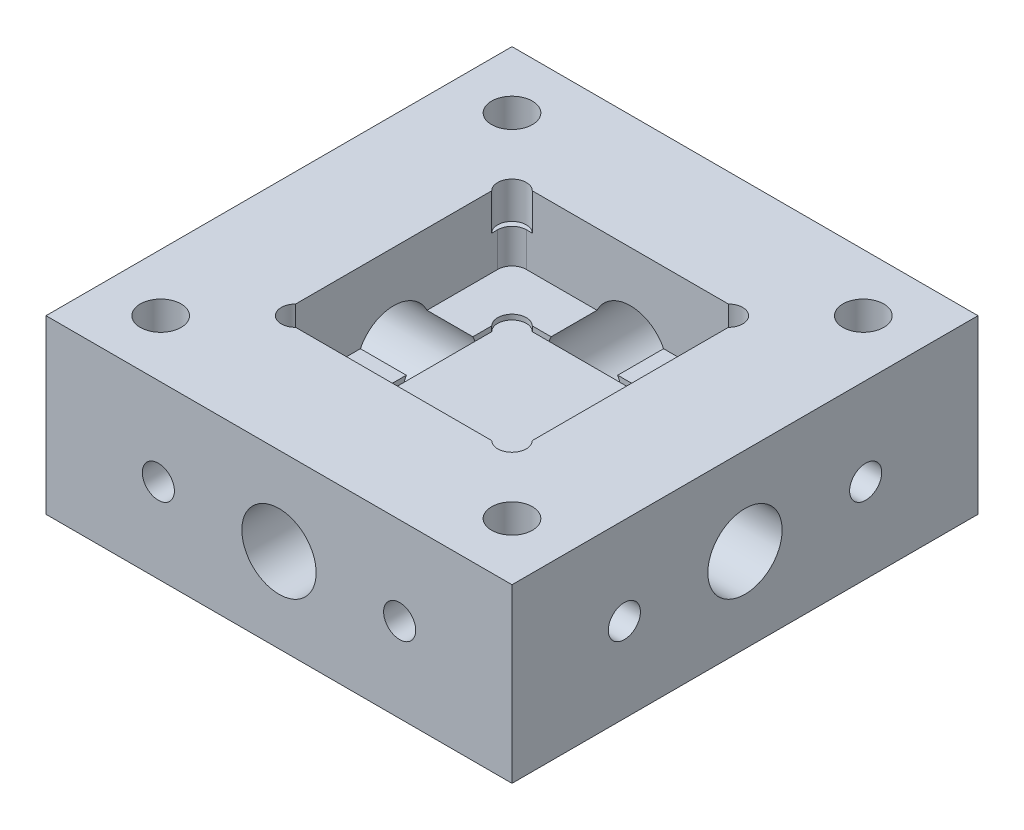
from build123d import *

# Parameters (mm, degrees)
SKETCH1_W             = 25.8
SKETCH1_H             = 25.8
BOSS_EXTRUDE1_DEPTH   = 9.525
SKETCH3_R             = 2.0574
CUT_EXTRUDE3_DEPTH    = 8.89
SKETCH7_R             = 2.0574
CUT_EXTRUDE5_DEPTH    = 8.89
CUT_EXTRUDE10_DEPTH   = 3.9376
CUT_EXTRUDE11_DEPTH   = 0.28
F_4_40_TAPPED_HOLE2_D = 2.2606
CUT_EXTRUDE12_DEPTH   = 2.032


with BuildPart() as part:
    # Sketch1 → Boss-Extrude1 (new body)
    with BuildSketch(Plane(origin=(0, 0, 0), x_dir=(1, 0, 0), z_dir=(0, 1, 0))):
        Rectangle(SKETCH1_W, SKETCH1_H)
    extrude(amount=BOSS_EXTRUDE1_DEPTH)

    # Sketch3 → Cut-Extrude3 (cut)
    with BuildSketch(Plane.ZY.offset(12.9)):
        with Locations((0, 4.6736)):
            Circle(SKETCH3_R)
    cut_extrude3 = extrude(amount=-CUT_EXTRUDE3_DEPTH, mode=Mode.SUBTRACT)

    # Mirror1: Cut-Extrude3 across plane
    add(cut_extrude3.mirror(Plane(origin=(0, 0, 0), x_dir=(0, 0, 1), z_dir=(1, 0, 0))), mode=Mode.SUBTRACT)

    # Sketch7 → Cut-Extrude5 (cut)
    with BuildSketch(Plane(origin=(0, 0, -12.9), x_dir=(-1, 0, 0), z_dir=(0, 0, -1))):
        with Locations((0, 4.6736)):
            Circle(SKETCH7_R)
    cut_extrude5 = extrude(amount=-CUT_EXTRUDE5_DEPTH, mode=Mode.SUBTRACT)

    # Mirror2: Cut-Extrude5 across plane
    add(cut_extrude5.mirror(Plane.XY), mode=Mode.SUBTRACT)

    # Sketch14 → Cut-Extrude10 (cut)
    with BuildSketch(Plane(origin=(0, 9.525, 0), x_dir=(1, 0, 0), z_dir=(0, 1, 0))):
        with BuildLine():
            Line((-5.75625, -6.55), (5.75625, -6.55))
            ThreePointArc((5.75625, -6.55), (6.317516008, -6.317516008), (6.55, -5.75625))
            Line((6.55, -5.75625), (6.55, 5.75625))
            ThreePointArc((6.55, 5.75625), (6.317516008, 6.317516008), (5.75625, 6.55))
            Line((5.75625, 6.55), (-5.75625, 6.55))
            ThreePointArc((-5.75625, 6.55), (-6.317516008, 6.317516008), (-6.55, 5.75625))
            Line((-6.55, 5.75625), (-6.55, -5.75625))
            ThreePointArc((-6.55, -5.75625), (-6.317516008, -6.317516008), (-5.75625, -6.55))
        make_face()
    extrude(amount=-CUT_EXTRUDE10_DEPTH, mode=Mode.SUBTRACT)

    # Sketch15 → Cut-Extrude11 (cut)
    with BuildSketch(Plane(origin=(0, 5.5874, 0), x_dir=(1, 0, 0), z_dir=(0, 1, 0))):
        with BuildLine():
            Line((-2.887467985, 4.01), (2.887467985, 4.01))
            ThreePointArc((2.887467985, 4.01), (4.01, 4.01), (4.01, 2.887467985))
            Line((4.01, 2.887467985), (4.01, -2.887467985))
            ThreePointArc((4.01, -2.887467985), (4.01, -4.01), (2.887467985, -4.01))
            Line((2.887467985, -4.01), (-2.887467985, -4.01))
            ThreePointArc((-2.887467985, -4.01), (-4.01, -4.01), (-4.01, -2.887467985))
            Line((-4.01, -2.887467985), (-4.01, 2.887467985))
            ThreePointArc((-4.01, 2.887467985), (-4.01, 4.01), (-2.887467985, 4.01))
        make_face()
    extrude(amount=-CUT_EXTRUDE11_DEPTH, mode=Mode.SUBTRACT)

    # #4-40 Tapped Hole2 (through all)
    with Locations(Plane(origin=(0, 9.525, 0), x_dir=(1, 0, 0), z_dir=(0, 1, 0))):
        with Locations((9.725, -9.725), (-9.725, -9.725), (-9.725, 9.725), (9.725, 9.725)):
            Hole(F_4_40_TAPPED_HOLE2_D / 2)

    # Sketch22 → #2-56 Tapped Hole1 (revolve, cut)
    with BuildSketch(Plane(origin=(-6.6802, 4.6736, -12.9), x_dir=(0, 1, 0), z_dir=(1, 0, 0))):
        Polygon((0, 0), (0, 5.61416509), (0.889, 5.08), (0.889, 0), align=None)
    f_2_56_tapped_hole1 = revolve(axis=Axis((-6.6802, 4.6736, -19.25), (0, 0, 1)), mode=Mode.SUBTRACT)

    # Mirror7: #2-56 Tapped Hole1 across plane
    add(f_2_56_tapped_hole1.mirror(Plane(origin=(0, 0, 0), x_dir=(0, 0, 1), z_dir=(1, 0, 0))), mode=Mode.SUBTRACT)

    # Mirror8: #2-56 Tapped Hole1 across plane
    add(f_2_56_tapped_hole1.mirror(Plane.XY), mode=Mode.SUBTRACT)

    # Mirror8 copy 1 sketch → Mirror8 copy 1 (revolve, cut)
    with BuildSketch(Plane(origin=(6.6802, 4.6736, 12.9), x_dir=(0, 1, 0), z_dir=(-1, 0, 0))):
        Polygon((0, 0), (0, 5.61416509), (0.889, 5.08), (0.889, 0), align=None)
    revolve(axis=Axis((6.6802, 4.6736, 19.25), (0, 0, -1)), mode=Mode.SUBTRACT)

    # Sketch24 → #2-56 Tapped Hole2 (revolve, cut)
    with BuildSketch(Plane(origin=(12.9, 4.6736, -6.6802), x_dir=(0, 0, -1), z_dir=(0, 1, 0))):
        Polygon((0, 0), (0, 5.61416509), (0.889, 5.08), (0.889, 0), align=None)
    f_2_56_tapped_hole2 = revolve(axis=Axis((19.25, 4.6736, -6.6802), (-1, 0, 0)), mode=Mode.SUBTRACT)

    # Mirror9: #2-56 Tapped Hole2 across plane
    add(f_2_56_tapped_hole2.mirror(Plane.XY), mode=Mode.SUBTRACT)

    # Mirror10: #2-56 Tapped Hole2 across plane
    add(f_2_56_tapped_hole2.mirror(Plane(origin=(0, 0, 0), x_dir=(0, 0, 1), z_dir=(1, 0, 0))), mode=Mode.SUBTRACT)

    # Mirror10 copy 1 sketch → Mirror10 copy 1 (revolve, cut)
    with BuildSketch(Plane(origin=(-12.9, 4.6736, 6.6802), x_dir=(0, 0, 1), z_dir=(0, 1, 0))):
        Polygon((0, 0), (0, 5.61416509), (0.889, 5.08), (0.889, 0), align=None)
    revolve(axis=Axis((-19.25, 4.6736, 6.6802), (1, 0, 0)), mode=Mode.SUBTRACT)

    # Sketch25 → Cut-Extrude12 (cut)
    with BuildSketch(Plane(origin=(0, 9.525, 0), x_dir=(1, 0, 0), z_dir=(0, 1, 0))):
        with BuildLine():
            Line((-5.427467966, -6.549999981), (5.427467966, -6.549999981))
            ThreePointArc((5.427467966, -6.549999981), (5.988733973, -6.782483973), (6.549999981, -6.549999981))
            ThreePointArc((6.549999981, -6.549999981), (6.782483973, -5.988733973), (6.549999981, -5.427467966))
            Line((6.549999981, -5.427467966), (6.549999981, 5.427467966))
            ThreePointArc((6.549999981, 5.427467966), (6.782483973, 5.988733973), (6.549999981, 6.549999981))
            ThreePointArc((6.549999981, 6.549999981), (5.988733973, 6.782483973), (5.427467966, 6.549999981))
            Line((5.427467966, 6.549999981), (-5.427467966, 6.549999981))
            ThreePointArc((-5.427467966, 6.549999981), (-5.988733973, 6.782483973), (-6.549999981, 6.549999981))
            ThreePointArc((-6.549999981, 6.549999981), (-6.782483973, 5.988733973), (-6.549999981, 5.427467966))
            Line((-6.549999981, 5.427467966), (-6.549999981, -5.427467966))
            ThreePointArc((-6.549999981, -5.427467966), (-6.782483973, -5.988733973), (-6.549999981, -6.549999981))
            ThreePointArc((-6.549999981, -6.549999981), (-5.988733973, -6.782483973), (-5.427467966, -6.549999981))
        make_face()
    extrude(amount=-CUT_EXTRUDE12_DEPTH, mode=Mode.SUBTRACT)


solid = part.part
